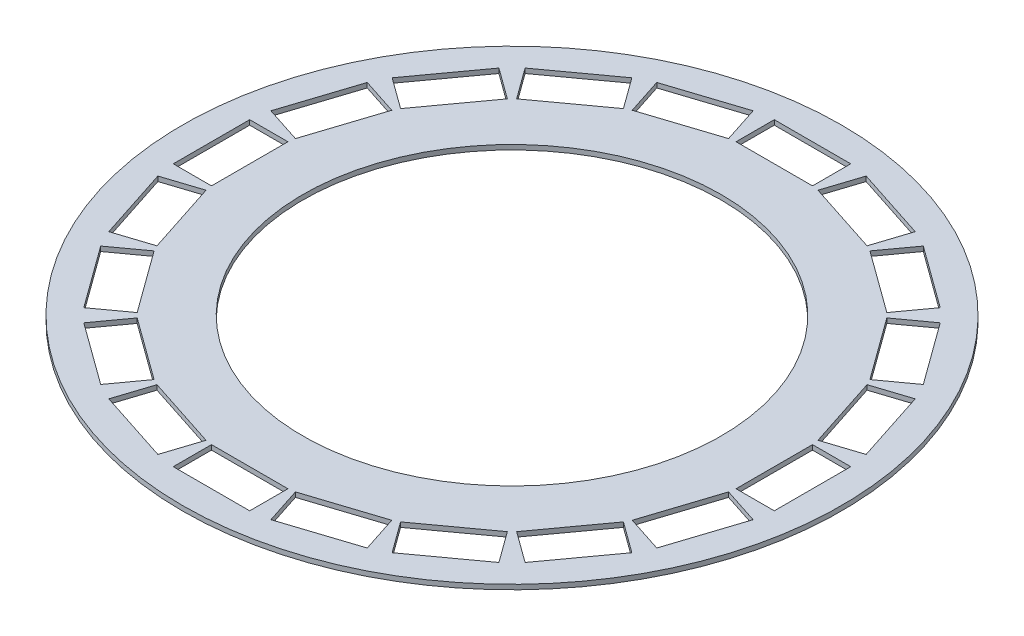
from build123d import *

# Parameters (mm, degrees)
SKETCH1_W          = 40
SKETCH1_H          = 1.5875
SKETCH2_W          = 25.4
SKETCH2_H          = 12.7
CUT_EXTRUDE1_DEPTH = 155.864521942
CIRPATTERN1_COUNT  = 20


with BuildPart() as part:
    # Sketch1 → Revolve1 (revolve)
    with BuildSketch(Plane.XY, mode=Mode.PRIVATE) as revolve1_sk:
        with Locations((-89.5, 6.57875)):
            Rectangle(SKETCH1_W, SKETCH1_H)
    revolve(revolve1_sk.sketch.rotate(Axis((0, -200069.047495165, 0), (0, 1, 0)), 270), axis=Axis((0, -200069.047495165, 0), (0, 1, 0)))

    # Sketch2 → Cut-Extrude1 (cut, through all)
    with BuildSketch(Plane(origin=(0, 7.3725, 0), x_dir=(1, 0, 0), z_dir=(0, 1, 0))):
        with Locations((0, 93.5)):
            Rectangle(SKETCH2_W, SKETCH2_H)
    cut_extrude1 = extrude(amount=-CUT_EXTRUDE1_DEPTH, mode=Mode.SUBTRACT)

    # CirPattern1: Cut-Extrude1 ×20 about axis
    cirpattern1_axis = Axis((0, 0, 0), (0, 1, 0))
    for i in range(1, CIRPATTERN1_COUNT):
        add(cut_extrude1.rotate(cirpattern1_axis, i * 360 / CIRPATTERN1_COUNT), mode=Mode.SUBTRACT)


solid = part.part
